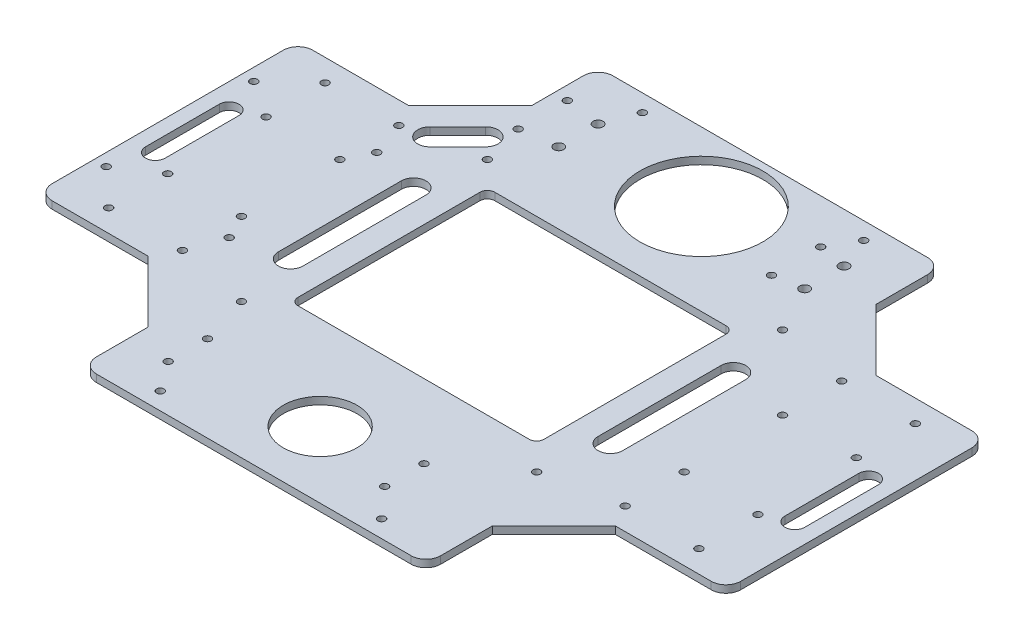
from build123d import *

# Parameters (mm, degrees)
EXTRUDE_1_DEPTH     = 3
SKETCH_2_R          = 1.5
CUT_EXTRUDE_1_DEPTH = 3
SKETCH_3_R          = 1.5
SKETCH_3_R_2        = 25
SKETCH_3_R_3        = 15
SKETCH_3_R_4        = 2
CUT_EXTRUDE_2_DEPTH = 10
SKETCH_4_W          = 100
SKETCH_4_H          = 80
CUT_EXTRUDE_3_DEPTH = 3
FILLET_2_R          = 3
SKETCH_5_R          = 1.5
CUT_EXTRUDE_4_DEPTH = 3
FILLET_3_R          = 6
CHAMFER_1_SIZE      = 25
SKETCH_7_R          = 1.5
CUT_EXTRUDE_6_DEPTH = 10


with BuildPart() as part:
    # 草图1 → 凸台-拉伸1 (new body)
    with BuildSketch(Plane(origin=(0, 0, 0), x_dir=(1, 0, 0), z_dir=(0, 1, 0))):
        Polygon((-70, -53), (-70, -105), (70, -105), (70, -53), (140, -53), (140, 53), (70, 53), (70, 105), (-70, 105), (-70, 53), (-140, 53), (-140, -53), align=None)
    extrude(amount=EXTRUDE_1_DEPTH)

    # 草图2 → 切除-拉伸1 (cut)
    with BuildSketch(Plane(origin=(0, 3, 0), x_dir=(1, 0, 0), z_dir=(0, 1, 0))):
        with Locations(Location((120, 44, 0), (0, 0, 270))):
            Circle(SKETCH_2_R)
        with Locations(Location((90, 44, 0), (0, 0, 270))):
            Circle(SKETCH_2_R)
        with Locations(Location((90, 20, 0), (0, 0, 270))):
            Circle(SKETCH_2_R)
        with Locations(Location((120, 20, 0), (0, 0, 270))):
            Circle(SKETCH_2_R)
        with Locations(Location((120, -20, 0), (0, 0, 90))):
            Circle(SKETCH_2_R)
        with Locations(Location((120, -44, 0), (0, 0, 90))):
            Circle(SKETCH_2_R)
        with Locations(Location((90, -20, 0), (0, 0, 90))):
            Circle(SKETCH_2_R)
        with Locations(Location((90, -44, 0), (0, 0, 90))):
            Circle(SKETCH_2_R)
        with Locations(Location((-90, -44, 0), (0, 0, 270))):
            Circle(SKETCH_2_R)
        with Locations(Location((-90, -20, 0), (0, 0, 270))):
            Circle(SKETCH_2_R)
        with Locations(Location((-120, -44, 0), (0, 0, 270))):
            Circle(SKETCH_2_R)
        with Locations(Location((-120, -20, 0), (0, 0, 270))):
            Circle(SKETCH_2_R)
        with Locations(Location((-120, 20, 0), (0, 0, 90))):
            Circle(SKETCH_2_R)
        with Locations(Location((-90, 20, 0), (0, 0, 90))):
            Circle(SKETCH_2_R)
        with Locations(Location((-90, 44, 0), (0, 0, 90))):
            Circle(SKETCH_2_R)
        with Locations(Location((-120, 44, 0), (0, 0, 90))):
            Circle(SKETCH_2_R)
    extrude(amount=-CUT_EXTRUDE_1_DEPTH, mode=Mode.SUBTRACT)

    # 草图3 → 切除-拉伸2 (cut)
    with BuildSketch(Plane(origin=(0, 3, 0), x_dir=(1, 0, 0), z_dir=(0, 1, 0))):
        with Locations(Location((-64.5, 87, 0), (0, 0, 270))):
            Circle(SKETCH_3_R)
        with Locations(Location((-64.5, 67, 0), (0, 0, 270))):
            Circle(SKETCH_3_R)
        with Locations(Location((0, 77, 0), (0, 0, 270))):
            Circle(SKETCH_3_R_2)
        with Locations(Location((34.2, -70, 0), (0, 0, 270))):
            Circle(SKETCH_3_R)
        with Locations(Location((34.2, -86, 0), (0, 0, 270))):
            Circle(SKETCH_3_R)
        with Locations(Location((0, -78, 0), (0, 0, 270))):
            Circle(SKETCH_3_R_3)
        with Locations(Location((-50, 85, 0), (0, 0, 270))):
            Circle(SKETCH_3_R_4)
        with Locations(Location((-50, 69, 0), (0, 0, 270))):
            Circle(SKETCH_3_R_4)
        with Locations(Location((50, 85, 0), (0, 0, 270))):
            Circle(SKETCH_3_R_4)
        with Locations(Location((50, 69, 0), (0, 0, 270))):
            Circle(SKETCH_3_R_4)
        with Locations(Location((38.5, 87, 0), (0, 0, 270))):
            Circle(SKETCH_3_R)
        with Locations(Location((38.5, 67, 0), (0, 0, 270))):
            Circle(SKETCH_3_R)
        with Locations(Location((-53.8, -86, 0), (0, 0, 270))):
            Circle(SKETCH_3_R)
        with Locations(Location((-53.8, -70, 0), (0, 0, 270))):
            Circle(SKETCH_3_R)
    extrude(amount=-CUT_EXTRUDE_2_DEPTH, mode=Mode.SUBTRACT)

    # 草图4 → 切除-拉伸3 (cut)
    with BuildSketch(Plane(origin=(0, 3, 0), x_dir=(1, 0, 0), z_dir=(0, 1, 0))):
        Rectangle(SKETCH_4_W, SKETCH_4_H)
    extrude(amount=-CUT_EXTRUDE_3_DEPTH, mode=Mode.SUBTRACT)

    # 圆角2
    fillet_2_edges = [part.edges().sort_by_distance(p)[0] for p in [
        (50, 1.5, -40),
        (50, 1.5, 40),
        (-50, 1.5, 40),
        (-50, 1.5, -40),
    ]]
    fillet(fillet_2_edges, radius=FILLET_2_R)

    # 草图5 → 切除-拉伸4 (cut)
    with BuildSketch(Plane(origin=(0, 3, 0), x_dir=(1, 0, 0), z_dir=(0, 1, 0))):
        with Locations(Location((-60, 50, 0), (0, 0, 270))):
            Circle(SKETCH_5_R)
        with Locations(Location((-45, 98, 0), (0, 0, 270))):
            Circle(SKETCH_5_R)
        with Locations(Location((60, 50, 0), (0, 0, 90))):
            Circle(SKETCH_5_R)
        with Locations(Location((45, 98, 0), (0, 0, 90))):
            Circle(SKETCH_5_R)
        with Locations(Location((45, -98, 0), (0, 0, 270))):
            Circle(SKETCH_5_R)
        with Locations(Location((60, -50, 0), (0, 0, 270))):
            Circle(SKETCH_5_R)
        with Locations(Location((-45, -98, 0), (0, 0, 90))):
            Circle(SKETCH_5_R)
        with Locations(Location((-60, -50, 0), (0, 0, 90))):
            Circle(SKETCH_5_R)
    extrude(amount=-CUT_EXTRUDE_4_DEPTH, mode=Mode.SUBTRACT)

    # 圆角3
    fillet_3_edges = [part.edges().sort_by_distance(p)[0] for p in [
        (-140, 1.5, 53),
        (-140, 1.5, -53),
        (-70, 1.5, -105),
        (70, 1.5, -105),
        (140, 1.5, -53),
        (140, 1.5, 53),
        (70, 1.5, 105),
        (-70, 1.5, 105),
    ]]
    fillet(fillet_3_edges, radius=FILLET_3_R)

    # 倒角1
    chamfer_1_edges = [part.edges().sort_by_distance(p)[0] for p in [
        (-70, 1.5, 53),
        (-70, 1.5, -53),
        (70, 1.5, -53),
        (70, 1.5, 53),
    ]]
    chamfer(chamfer_1_edges, length=CHAMFER_1_SIZE)

    # 草图7 → 切除-拉伸6 (cut)
    with BuildSketch(Plane(origin=(0, 3, 0), x_dir=(1, 0, 0), z_dir=(0, 1, 0))):
        with Locations(Location((-135, 30, 0), (0, 0, 270))):
            Circle(SKETCH_7_R)
        with Locations(Location((-85, 30, 0), (0, 0, 270))):
            Circle(SKETCH_7_R)
        with Locations(Location((-85, -30, 0), (0, 0, 270))):
            Circle(SKETCH_7_R)
        with Locations(Location((-135, -30, 0), (0, 0, 270))):
            Circle(SKETCH_7_R)
        with BuildLine():
            Line((-134, -15), (-134, 15))
            ThreePointArc((-134, 15), (-130, 19), (-126, 15))
            Line((-126, 15), (-126, -15))
            ThreePointArc((-126, -15), (-130, -19), (-134, -15))
        make_face()
        with BuildLine():
            Line((-70, -25), (-70, 25))
            ThreePointArc((-70, 25), (-65, 30), (-60, 25))
            Line((-60, 25), (-60, -25))
            ThreePointArc((-60, -25), (-65, -30), (-70, -25))
        make_face()
        with BuildLine():
            Line((-83.192388155, 49.878679656), (-71.878679656, 61.192388155))
            ThreePointArc((-71.878679656, 61.192388155), (-64.807611845, 61.192388155), (-64.807611845, 54.121320344))
            Line((-64.807611845, 54.121320344), (-76.121320344, 42.807611845))
            ThreePointArc((-76.121320344, 42.807611845), (-83.192388155, 42.807611845), (-83.192388155, 49.878679656))
        make_face()
        with BuildLine():
            Line((134, -15), (134, 15))
            ThreePointArc((134, 15), (130, 19), (126, 15))
            Line((126, 15), (126, -15))
            ThreePointArc((126, -15), (130, -19), (134, -15))
        make_face()
        with BuildLine():
            Line((70, -25), (70, 25))
            ThreePointArc((70, 25), (65, 30), (60, 25))
            Line((60, 25), (60, -25))
            ThreePointArc((60, -25), (65, -30), (70, -25))
        make_face()
    extrude(amount=-CUT_EXTRUDE_6_DEPTH, mode=Mode.SUBTRACT)


solid = part.part
